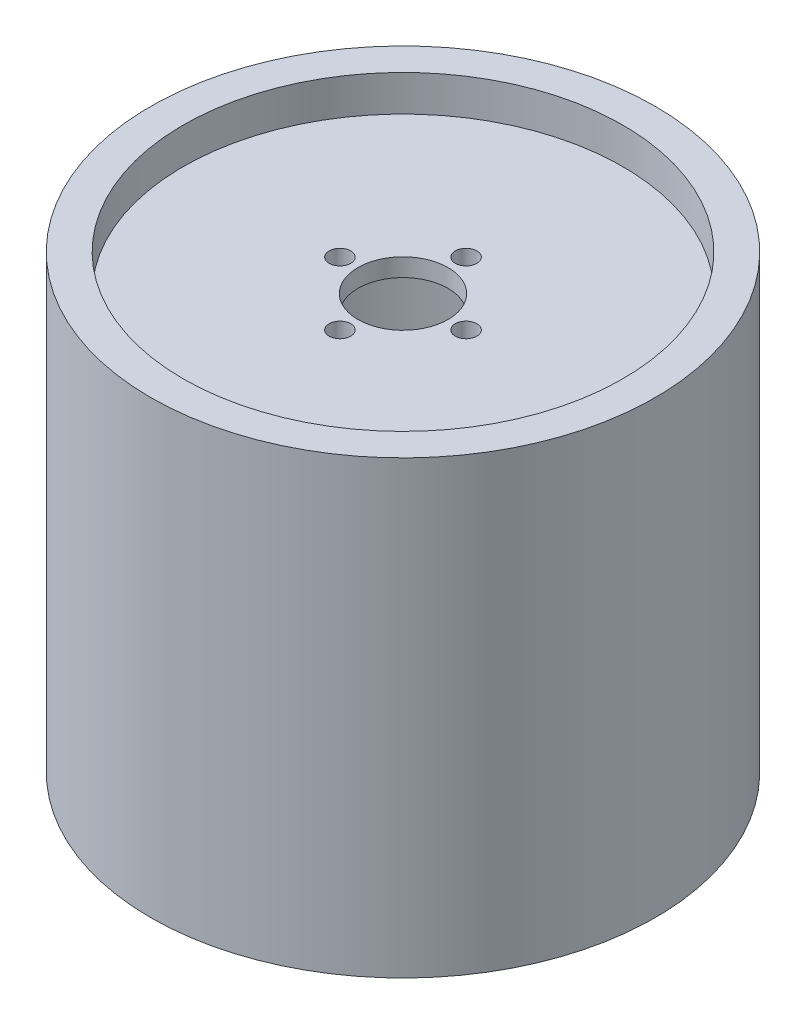
from build123d import *

# Parameters (mm, degrees)
SKETCH_1_R          = 70
EXTRUDE_1_DEPTH     = 125
SKETCH_4_R          = 60
CUT_EXTRUDE_4_DEPTH = 110
SKETCH_5_R          = 61
CUT_EXTRUDE_5_DEPTH = 10
SKETCH_6_R          = 12.5
SKETCH_6_R_2        = 3
CUT_EXTRUDE_6_DEPTH = 152.739909055
SKETCH_7_R          = 60
SKETCH_7_R_2        = 50
EXTRUDE_2_DEPTH     = 5
SKETCH_8_R          = 2.5
CUT_EXTRUDE_7_DEPTH = 5


with BuildPart() as part:
    # 스케치1 → 보스-돌출1 (new body)
    with BuildSketch(Plane(origin=(0, 0, 0), x_dir=(1, 0, 0), z_dir=(0, 1, 0))):
        with Locations(Location((0, 0, 0), (0, 0, 270))):
            Circle(SKETCH_1_R)
    extrude(amount=EXTRUDE_1_DEPTH)

    # 스케치4 → 컷-돌출4 (cut)
    with BuildSketch(Plane.XZ):
        with Locations(Location((0, 0, 0), (0, 0, 270))):
            Circle(SKETCH_4_R)
    extrude(amount=-CUT_EXTRUDE_4_DEPTH, mode=Mode.SUBTRACT)

    # 스케치5 → 컷-돌출5 (cut)
    with BuildSketch(Plane(origin=(0, 125, 0), x_dir=(1, 0, 0), z_dir=(0, 1, 0))):
        with Locations(Location((0, 0, 0), (0, 0, 270))):
            Circle(SKETCH_5_R)
    extrude(amount=-CUT_EXTRUDE_5_DEPTH, mode=Mode.SUBTRACT)

    # 스케치6 → 컷-돌출6 (cut, through all)
    with BuildSketch(Plane(origin=(0, 115, 0), x_dir=(1, 0, 0), z_dir=(0, 1, 0))):
        with Locations(Location((0, 0, 0), (0, 0, 270))):
            Circle(SKETCH_6_R)
        with Locations(Location((0, -17.5, 0), (0, 0, 270))):
            Circle(SKETCH_6_R_2)
        with Locations(Location((-17.5, 0, 0), (0, 0, 270))):
            Circle(SKETCH_6_R_2)
        with Locations(Location((0, 17.5, 0), (0, 0, 270))):
            Circle(SKETCH_6_R_2)
        with Locations(Location((17.5, 0, 0), (0, 0, 270))):
            Circle(SKETCH_6_R_2)
    extrude(amount=-CUT_EXTRUDE_6_DEPTH, mode=Mode.SUBTRACT)

    # 스케치7 → 보스-돌출2 (add)
    with BuildSketch(Plane.XZ):
        with Locations(Location((0, 0, 0), (0, 0, 270))):
            Circle(SKETCH_7_R)
        with Locations(Location((0, 0, 0), (0, 0, 270))):
            Circle(SKETCH_7_R_2, mode=Mode.SUBTRACT)
    extrude(amount=-EXTRUDE_2_DEPTH)

    # 스케치8 → 컷-돌출7 (cut)
    with BuildSketch(Plane.XZ):
        with Locations(Location((0, -55, 0), (0, 0, 270))):
            Circle(SKETCH_8_R)
        with Locations(Location((-55, 0, 0), (0, 0, 270))):
            Circle(SKETCH_8_R)
        with Locations(Location((0, 55, 0), (0, 0, 270))):
            Circle(SKETCH_8_R)
        with Locations(Location((55, 0, 0), (0, 0, 270))):
            Circle(SKETCH_8_R)
    extrude(amount=-CUT_EXTRUDE_7_DEPTH, mode=Mode.SUBTRACT)


solid = part.part
